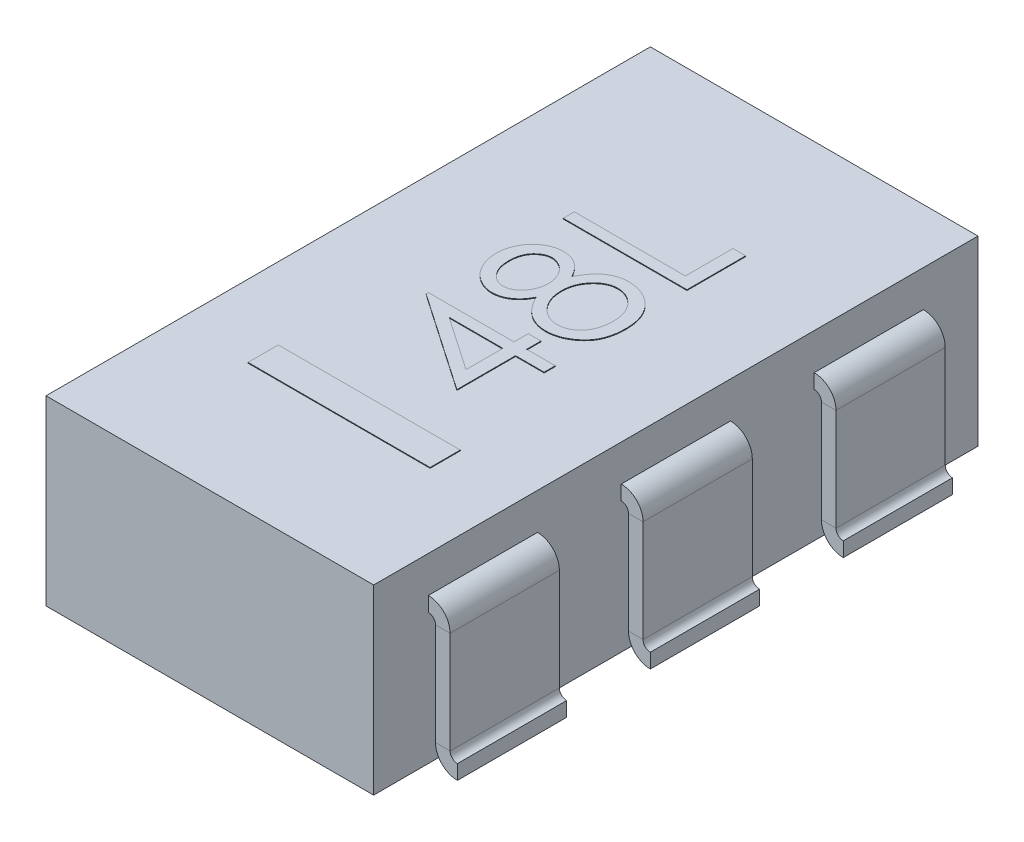
from build123d import *

# Parameters (mm, degrees)
SKETCH1_W           = 1.143
SKETCH1_H           = 2.1082
BOSS_EXTRUDE1_DEPTH = 0.635
SKETCH2_W           = 0.381
SKETCH2_H           = 0.0508
SKETCH4_W           = 0.381
SKETCH4_H           = 0.0508
SKETCH5_W           = 0.635
SKETCH5_H           = 0.105345301
BOSS_EXTRUDE2_DEPTH = 0.00254


with BuildPart() as part:
    # Sketch1 → Boss-Extrude1 (new body)
    with BuildSketch(Plane(origin=(0, 0, 0), x_dir=(1, 0, 0), z_dir=(0, 1, 0))):
        Rectangle(SKETCH1_W, SKETCH1_H)
    extrude(amount=BOSS_EXTRUDE1_DEPTH)

    # Sweep1: sweep along a path in Sketch3
    with BuildLine(Plane.XY) as sweep1_path:
        ThreePointArc((0.5715, 0.4572), (0.589460512, 0.449760512), (0.5969, 0.4318))
        Line((0.5969, 0.4318), (0.5969, 0.0762))
        ThreePointArc((0.5969, 0.0762), (0.619218463, 0.022318463), (0.6731, 0))
    # Sketch2 → Sweep1 (sweep)
    with BuildSketch(Plane(origin=(0.5715, 0, 0), x_dir=(0, 0, -1), z_dir=(1, 0, 0))):
        with Locations((-0.6731, 0.4826)):
            Rectangle(SKETCH2_W, SKETCH2_H)
        with Locations((0.6731, 0.4826)):
            Rectangle(SKETCH2_W, SKETCH2_H)
    sweep1 = sweep(path=sweep1_path.line)

    # Mirror1: Sweep1 across plane
    add(sweep1.mirror(Plane(origin=(0, 0, 0), x_dir=(0, 0, 1), z_dir=(1, 0, 0))))

    # Sweep2: sweep along a path in Sketch3<2>
    with BuildLine(Plane.XY) as sweep2_path:
        ThreePointArc((0.5715, 0.4572), (0.589460512, 0.449760512), (0.5969, 0.4318))
        Line((0.5969, 0.4318), (0.5969, 0.0762))
        ThreePointArc((0.5969, 0.0762), (0.619218463, 0.022318463), (0.6731, 0))
    # Sketch4 → Sweep2 (sweep)
    with BuildSketch(Plane(origin=(0.5715, 0, 0), x_dir=(0, 0, -1), z_dir=(1, 0, 0))):
        with Locations((0, 0.4826)):
            Rectangle(SKETCH4_W, SKETCH4_H)
    sweep(path=sweep2_path.line)

    # Sketch5 → Boss-Extrude2 (add)
    # profile 1 of 4: a face of its own
    with BuildSketch(Plane(origin=(0, 0.635, 0), x_dir=(1, 0, 0), z_dir=(0, 1, 0))):
        with Locations((0, -0.550584749)):
            Rectangle(SKETCH5_W, SKETCH5_H)
    # profile 2 of 4: a face of its own
    with BuildSketch(Plane(origin=(0, 0.635, 0), x_dir=(1, 0, 0), z_dir=(0, 1, 0))):
        Polygon((-0.2032, 0.381821502), (-0.2032, 0.420572784), (0.184312821, 0.420572784), (0.184312821, 0.586649707), (0.2286, 0.586649707), (0.2286, 0.381821502), align=None)
    # profile 3 of 4: a face of its own
    with BuildSketch(Plane(origin=(0, 0.635, 0), x_dir=(1, 0, 0), z_dir=(0, 1, 0))):
        with BuildLine():
            add(Edge.make_bspline(
                [(-0.011952043, 0.220847984), (-0.010111741, 0.224384176), (-0.006522538, 0.231280932), (-0.000707028, 0.241060038), (0.005264105, 0.250121074), (0.011504946, 0.258414433), (0.017875805, 0.266046218), (0.024458625, 0.272903866), (0.031244508, 0.279016359), (0.038258547, 0.284373955), (0.045501975, 0.28911542), (0.053020841, 0.29313765), (0.060713701, 0.296646515), (0.068695436, 0.299400907), (0.076857052, 0.30167487), (0.085307927, 0.303238342), (0.093991295, 0.304079445), (0.099859871, 0.304238435), (0.10283133, 0.304318938)],
                knots=[0, 0, 0, 0, 1.272232798, 2.48127884, 3.629933602, 4.734339846, 5.792529071, 6.8014233, 7.765980239, 8.70477066, 9.616091719, 10.526157162, 11.424183119, 12.311964017, 13.218439077, 14.126407968, 15.05133675, 16, 16, 16, 16], degree=3))
            add(Edge.make_bspline(
                [(0.10283133, 0.304318938), (0.106988563, 0.304223457), (0.115217288, 0.304034465), (0.12736424, 0.302398126), (0.139181338, 0.29991907), (0.150645647, 0.296389239), (0.161648631, 0.291672093), (0.172253926, 0.285967103), (0.182642414, 0.27947198), (0.18903569, 0.274259863), (0.192270673, 0.271622543)],
                knots=[0, 0, 0, 0, 1.025234619, 2.029323995, 3.018511574, 4.001747246, 4.983437759, 5.966776356, 6.971193253, 8, 8, 8, 8], degree=3))
            add(Edge.make_bspline(
                [(0.192270673, 0.271622543), (0.196045071, 0.268188318), (0.203547225, 0.261362304), (0.213287499, 0.249668799), (0.221473118, 0.236835471), (0.228144045, 0.222911977), (0.233336238, 0.207935537), (0.2370673, 0.191909341), (0.239204393, 0.174802146), (0.239513314, 0.163044174), (0.239671795, 0.157012167)],
                knots=[0, 0, 0, 0, 0.954267603, 1.896743057, 2.838368354, 3.796610408, 4.779680527, 5.799409237, 6.871065594, 8, 8, 8, 8], degree=3))
            add(Edge.make_bspline(
                [(0.239671795, 0.157012167), (0.239529612, 0.151212058), (0.239252939, 0.139925635), (0.23737838, 0.123497757), (0.234093262, 0.108184518), (0.229597039, 0.093896874), (0.223747968, 0.080720975), (0.216468029, 0.068694316), (0.208050171, 0.057643554), (0.198252921, 0.047903415), (0.187758561, 0.039257962), (0.176934821, 0.031657053), (0.16579004, 0.025374892), (0.154493624, 0.019960182), (0.142816715, 0.015930585), (0.130879137, 0.01307253), (0.118714804, 0.011277272), (0.110506933, 0.011037165), (0.106377764, 0.010916374)],
                knots=[0, 0, 0, 0, 1.25688423, 2.445769047, 3.576901867, 4.645929967, 5.686364546, 6.692558921, 7.686102643, 8.689032542, 9.678639083, 10.630214757, 11.550908986, 12.44815258, 13.341318614, 14.221806242, 15.105436345, 16, 16, 16, 16], degree=3))
            add(Edge.make_bspline(
                [(0.106377764, 0.010916374), (0.103347871, 0.010987689), (0.097359732, 0.011128632), (0.088512718, 0.012103562), (0.079902357, 0.013672543), (0.07149393, 0.015797725), (0.063334524, 0.018707749), (0.055371861, 0.022147545), (0.047658155, 0.026236866), (0.040136249, 0.030931435), (0.032895926, 0.036396912), (0.025820323, 0.042590094), (0.018998408, 0.04959352), (0.012469494, 0.057457224), (0.005895904, 0.06590509), (-0.000235446, 0.075294438), (-0.006388492, 0.085327065), (-0.010065707, 0.092458839), (-0.011952043, 0.096117295)],
                knots=[0, 0, 0, 0, 0.941515718, 1.860767376, 2.762381872, 3.659935523, 4.55260077, 5.451495189, 6.353332278, 7.263234701, 8.204067976, 9.169206831, 10.183030162, 11.238523545, 12.34427893, 13.507326683, 14.721309093, 16, 16, 16, 16], degree=3))
            add(Edge.make_bspline(
                [(-0.011952043, 0.096117295), (-0.014691198, 0.091116094), (-0.019986674, 0.081447511), (-0.029587344, 0.068514615), (-0.040212621, 0.057577178), (-0.051753545, 0.04862643), (-0.063979758, 0.041616168), (-0.076789476, 0.036800822), (-0.089955633, 0.033544654), (-0.098950116, 0.033222005), (-0.103467348, 0.033059963)],
                knots=[0, 0, 0, 0, 1.166795445, 2.255709742, 3.287146686, 4.280506455, 5.237809939, 6.161201476, 7.076514059, 8, 8, 8, 8], degree=3))
            add(Edge.make_bspline(
                [(-0.103467348, 0.033059963), (-0.108068593, 0.033262082), (-0.117317899, 0.033668376), (-0.1310901, 0.036942547), (-0.144624398, 0.042318225), (-0.157887554, 0.049505986), (-0.170282443, 0.058648411), (-0.181451509, 0.069472062), (-0.191232007, 0.081889794), (-0.199446799, 0.095786833), (-0.206131187, 0.110744394), (-0.210742704, 0.126525413), (-0.213757399, 0.14285569), (-0.214098729, 0.15397117), (-0.214271795, 0.159607119)],
                knots=[0, 0, 0, 0, 0.888671842, 1.786385383, 2.719922424, 3.697584571, 4.694127107, 5.68736021, 6.695307759, 7.740011808, 8.800474061, 9.853175224, 10.911482437, 12, 12, 12, 12], degree=3))
            add(Edge.make_bspline(
                [(-0.214271795, 0.159607119), (-0.214093364, 0.165097625), (-0.213741519, 0.175924278), (-0.210806801, 0.191838429), (-0.205905677, 0.207065909), (-0.199254942, 0.221551947), (-0.191069668, 0.235045536), (-0.181146068, 0.246928757), (-0.170108751, 0.2575124), (-0.157643244, 0.266217922), (-0.144431102, 0.273349529), (-0.13064388, 0.278370664), (-0.116559164, 0.281568374), (-0.107030465, 0.281972748), (-0.10225637, 0.282175348)],
                knots=[0, 0, 0, 0, 1.072838999, 2.115516285, 3.151283082, 4.193045685, 5.225601509, 6.226687556, 7.21162948, 8.206378771, 9.189883966, 10.138656908, 11.067424936, 12, 12, 12, 12], degree=3))
            add(Edge.make_bspline(
                [(-0.10225637, 0.282175348), (-0.097571574, 0.281997268), (-0.0883709, 0.281647529), (-0.074977302, 0.278744991), (-0.062461729, 0.273778776), (-0.050622662, 0.267086309), (-0.039700047, 0.258288343), (-0.029464412, 0.247665023), (-0.020033263, 0.235105075), (-0.014702126, 0.225699749), (-0.011952043, 0.220847984)],
                knots=[0, 0, 0, 0, 0.97540661, 1.915643144, 2.83819279, 3.771804602, 4.738123289, 5.749225578, 6.838931607, 8, 8, 8, 8], degree=3))
        make_face()
        with BuildLine():
            add(Edge.make_bspline(
                [(-0.169984615, 0.157444659), (-0.169904506, 0.154415685), (-0.169747778, 0.148489688), (-0.168922648, 0.139802285), (-0.167337704, 0.131534474), (-0.16516635, 0.123641043), (-0.162464752, 0.116094953), (-0.158905304, 0.109069248), (-0.154948963, 0.102327826), (-0.150308355, 0.096091844), (-0.145245351, 0.090446698), (-0.139957841, 0.085404586), (-0.134289951, 0.081296831), (-0.128525239, 0.077762778), (-0.122424598, 0.07513825), (-0.116121604, 0.073273876), (-0.109576334, 0.071954444), (-0.105117413, 0.071859349), (-0.102861859, 0.071811245)],
                knots=[0, 0, 0, 0, 1.20353747, 2.354645537, 3.462130888, 4.543058862, 5.604822423, 6.639552563, 7.666902586, 8.706944258, 9.720926464, 10.677177239, 11.602682187, 12.496457588, 13.358248655, 14.231532794, 15.105417644, 16, 16, 16, 16], degree=3))
            add(Edge.make_bspline(
                [(-0.102861859, 0.071811245), (-0.100606566, 0.071896047), (-0.096149784, 0.072063627), (-0.089568429, 0.073359659), (-0.083101096, 0.075291268), (-0.07690157, 0.078332455), (-0.070754791, 0.081980099), (-0.064814384, 0.086482105), (-0.059059676, 0.091847408), (-0.053539614, 0.097895993), (-0.048370504, 0.104485451), (-0.043883092, 0.111466305), (-0.040128393, 0.118750943), (-0.037003468, 0.126264518), (-0.034574292, 0.134083608), (-0.03285096, 0.1421603), (-0.03177985, 0.150495953), (-0.031651911, 0.156143968), (-0.031587179, 0.15900163)],
                knots=[0, 0, 0, 0, 0.873023192, 1.725219244, 2.590779336, 3.480155217, 4.391973325, 5.357036234, 6.360879153, 7.436073238, 8.526419356, 9.601555421, 10.645666583, 11.697338044, 12.750135903, 13.812665442, 14.89329948, 16, 16, 16, 16], degree=3))
            add(Edge.make_bspline(
                [(-0.031587179, 0.15900163), (-0.031694323, 0.162672163), (-0.031907553, 0.169976974), (-0.033908176, 0.1807415), (-0.037015334, 0.191234427), (-0.041425383, 0.201257208), (-0.046802292, 0.210630462), (-0.053143172, 0.219089822), (-0.060596935, 0.226281282), (-0.068731206, 0.232399383), (-0.077359701, 0.237182873), (-0.086054047, 0.240847101), (-0.094885859, 0.243005007), (-0.100803852, 0.243285517), (-0.103726843, 0.243424066)],
                knots=[0, 0, 0, 0, 1.076561449, 2.142489767, 3.202892658, 4.283174188, 5.348766409, 6.369549039, 7.375093932, 8.378927502, 9.349008457, 10.26378795, 11.142457041, 12, 12, 12, 12], degree=3))
            add(Edge.make_bspline(
                [(-0.103726843, 0.243424066), (-0.105778599, 0.243359489), (-0.109851041, 0.243231313), (-0.115886377, 0.242137675), (-0.121781152, 0.240418387), (-0.127547549, 0.237957767), (-0.133157762, 0.234797862), (-0.138760784, 0.231103985), (-0.144097562, 0.226519769), (-0.149353377, 0.221418857), (-0.154203197, 0.215621617), (-0.158500142, 0.20918343), (-0.162003627, 0.202029271), (-0.164979438, 0.194312465), (-0.167183506, 0.185949855), (-0.168843909, 0.177020034), (-0.16977743, 0.16744053), (-0.169914056, 0.160848882), (-0.169984615, 0.157444659)],
                knots=[0, 0, 0, 0, 0.814197944, 1.616066217, 2.427603245, 3.248455667, 4.099186941, 4.981981106, 5.90846497, 6.888109974, 7.887887681, 8.904052014, 9.953721043, 11.044545063, 12.183287691, 13.382474488, 14.648192314, 16, 16, 16, 16], degree=3))
        make_face(mode=Mode.SUBTRACT)
        with BuildLine():
            add(Edge.make_bspline(
                [(0.0127, 0.159953112), (0.012768349, 0.156113104), (0.012902432, 0.148579944), (0.014393294, 0.137543176), (0.016471879, 0.126952581), (0.019613263, 0.116836606), (0.023734328, 0.107238586), (0.028538399, 0.097994369), (0.034385226, 0.089329499), (0.041028183, 0.081261682), (0.048191449, 0.073858498), (0.055853168, 0.067453655), (0.06371656, 0.061931985), (0.071960961, 0.05751612), (0.080404352, 0.053886258), (0.089263645, 0.05150382), (0.09836679, 0.049976179), (0.104555124, 0.04977107), (0.10767524, 0.049667656)],
                knots=[0, 0, 0, 0, 1.140120093, 2.236637429, 3.303440304, 4.343881959, 5.376465234, 6.40341898, 7.434544382, 8.475444373, 9.50525236, 10.49018835, 11.438301835, 12.354413346, 13.264416842, 14.162243115, 15.073415118, 16, 16, 16, 16], degree=3))
            add(Edge.make_bspline(
                [(0.10767524, 0.049667656), (0.11155199, 0.049839415), (0.119271525, 0.05018143), (0.130655922, 0.052783437), (0.141642805, 0.057089872), (0.152181017, 0.062985725), (0.162036105, 0.070331472), (0.170648643, 0.079320385), (0.178177952, 0.089525512), (0.18438414, 0.101102087), (0.189277257, 0.113809877), (0.19282175, 0.12753384), (0.195033223, 0.142177907), (0.195265639, 0.152275546), (0.195384615, 0.157444659)],
                knots=[0, 0, 0, 0, 0.898929492, 1.789983246, 2.69439732, 3.628772362, 4.584083338, 5.535003999, 6.506411961, 7.518169435, 8.572915583, 9.658441722, 10.801325702, 12, 12, 12, 12], degree=3))
            add(Edge.make_bspline(
                [(0.195384615, 0.157444659), (0.195306042, 0.161484802), (0.195152957, 0.169356296), (0.193832577, 0.180844826), (0.191669284, 0.191658723), (0.188765095, 0.201886297), (0.184842757, 0.211442145), (0.180048273, 0.220367415), (0.174540355, 0.228774335), (0.168022214, 0.236284391), (0.161053463, 0.243122962), (0.153677284, 0.249085987), (0.146092895, 0.25426233), (0.138129223, 0.258325074), (0.129938971, 0.26157298), (0.121446636, 0.263907607), (0.112626167, 0.265348118), (0.106642768, 0.265493807), (0.103609816, 0.265567656)],
                knots=[0, 0, 0, 0, 1.224881218, 2.3864614, 3.501053153, 4.5663711, 5.605533372, 6.626474706, 7.635288001, 8.646258782, 9.635558885, 10.592810877, 11.51917626, 12.414699553, 13.29797396, 14.186770504, 15.080884095, 16, 16, 16, 16], degree=3))
            add(Edge.make_bspline(
                [(0.103609816, 0.265567656), (0.100664029, 0.265455906), (0.094855452, 0.265235555), (0.086248331, 0.263836844), (0.077932464, 0.261380126), (0.069809539, 0.258007442), (0.062037518, 0.253523958), (0.054421991, 0.248206502), (0.047093244, 0.241888198), (0.040153451, 0.23464675), (0.033740133, 0.226793938), (0.028040175, 0.218472933), (0.023381691, 0.209644292), (0.019468197, 0.200483305), (0.016418397, 0.190897515), (0.014279834, 0.180933187), (0.01293575, 0.170571436), (0.012779471, 0.163532541), (0.0127, 0.159953112)],
                knots=[0, 0, 0, 0, 0.917285732, 1.808727228, 2.70647511, 3.61182169, 4.540502712, 5.494399442, 6.50027777, 7.547876848, 8.61347749, 9.654284431, 10.682470341, 11.71628462, 12.752590585, 13.809114363, 14.885888007, 16, 16, 16, 16], degree=3))
        make_face(mode=Mode.SUBTRACT)
    # profile 4 of 4: a face of its own
    with BuildSketch(Plane(origin=(0, 0.635, 0), x_dir=(1, 0, 0), z_dir=(0, 1, 0))):
        Polygon((-0.214271795, -0.08552934), (-0.214271795, -0.077657985), (0.084666667, -0.077657985), (0.084666667, -0.027834908), (0.128953846, -0.027834908), (0.128953846, -0.077657985), (0.2286, -0.077657985), (0.2286, -0.116409267), (0.128953846, -0.116409267), (0.128953846, -0.321237473), align=None)
        Polygon((0.084666667, -0.116409267), (-0.102861859, -0.116409267), (0.084666667, -0.245118883), align=None, mode=Mode.SUBTRACT)
    extrude(amount=BOSS_EXTRUDE2_DEPTH)


solid = part.part
